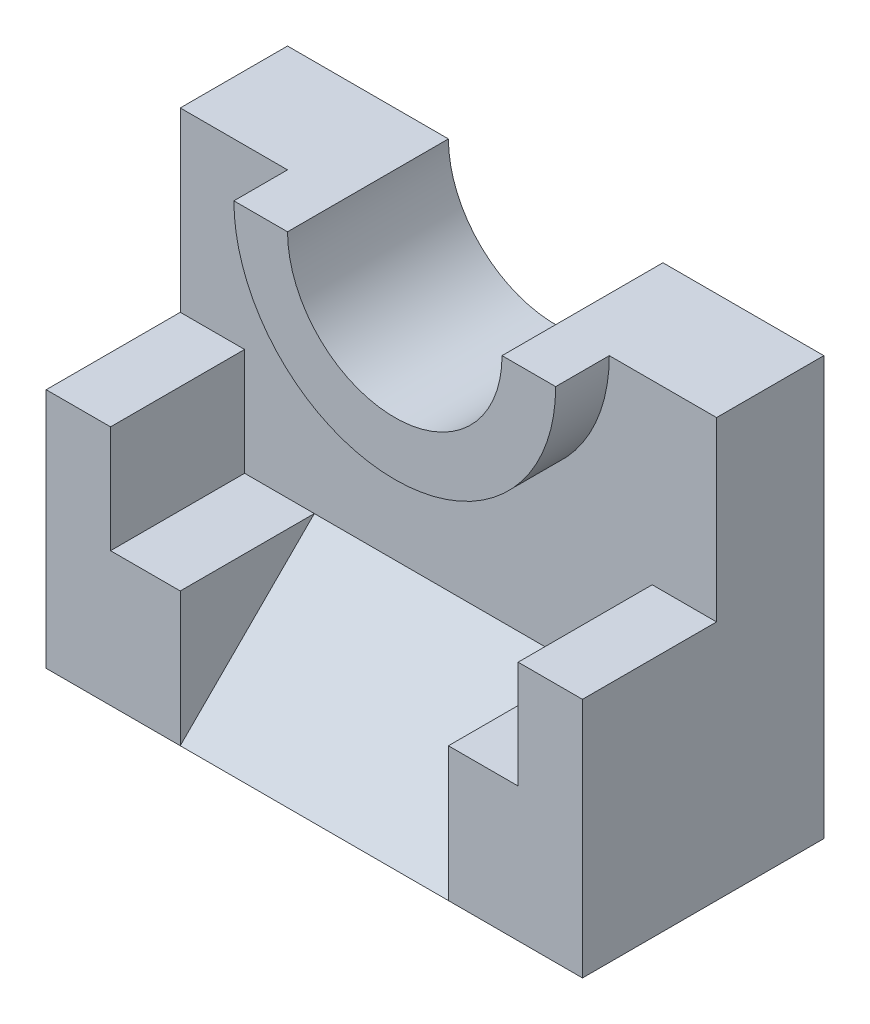
from build123d import *

# Parameters (mm, degrees)
BOSS_EXTRUDE1_DEPTH = 20
BOSS_EXTRUDE2_DEPTH = 30
BOSS_EXTRUDE6_DEPTH = 45
CUT_EXTRUDE6_DEPTH  = 140
BOSS_EXTRUDE7_DEPTH = 25


with BuildPart() as part:
    # Sketch1 → Boss-Extrude1 (new body)
    with BuildSketch(Plane.XY):
        with BuildLine():
            Line((-68.304856892, 40.883398519), (-68.304856892, 7.883398519))
            Line((-68.304856892, 7.883398519), (-56.304856892, 7.883398519))
            Line((-56.304856892, 7.883398519), (-56.304856892, -12.116601481))
            Line((-56.304856892, -12.116601481), (19.695143108, -12.116601481))
            Line((19.695143108, -12.116601481), (19.695143108, 7.883398519))
            Line((19.695143108, 7.883398519), (31.695143108, 7.883398519))
            Line((31.695143108, 7.883398519), (31.695143108, 40.883398519))
            Line((31.695143108, 40.883398519), (11.695143108, 40.883398519))
            ThreePointArc((11.695143108, 40.883398519), (-18.304856892, 10.883398519), (-48.304856892, 40.883398519))
            Line((-48.304856892, 40.883398519), (-68.304856892, 40.883398519))
        make_face()
    extrude(amount=BOSS_EXTRUDE1_DEPTH)

    # Sketch1<3> → Boss-Extrude2 (add)
    with BuildSketch(Plane.XY):
        with BuildLine():
            Line((-38.304856892, 40.883398519), (-48.304856892, 40.883398519))
            ThreePointArc((-48.304856892, 40.883398519), (-18.304856892, 10.883398519), (11.695143108, 40.883398519))
            Line((11.695143108, 40.883398519), (1.695143108, 40.883398519))
            ThreePointArc((1.695143108, 40.883398519), (-18.304856892, 20.883398519), (-38.304856892, 40.883398519))
        make_face()
    extrude(amount=BOSS_EXTRUDE2_DEPTH)

    # Sketch1<6> → Boss-Extrude6 (add)
    with BuildSketch(Plane.XY):
        Polygon((-68.304856892, 7.883398519), (-68.304856892, -37.116601481), (31.695143108, -37.116601481), (31.695143108, 7.883398519), (19.695143108, 7.883398519), (19.695143108, -12.116601481), (-56.304856892, -12.116601481), (-56.304856892, 7.883398519), align=None)
    extrude(amount=BOSS_EXTRUDE6_DEPTH)

    # Sketch3 → Cut-Extrude6 (cut)
    with BuildSketch(Plane.ZY.offset(68.304856892)):
        Polygon((45, -37.116601481), (45, -12.116601481), (20, -12.116601481), align=None)
    extrude(amount=-CUT_EXTRUDE6_DEPTH, mode=Mode.SUBTRACT)

    # Sketch3<2> → Boss-Extrude7 (add)
    with BuildSketch(Plane.ZY.offset(68.304856892)):
        Polygon((45, -37.116601481), (45, -12.116601481), (20, -12.116601481), align=None)
    boss_extrude7 = extrude(amount=-BOSS_EXTRUDE7_DEPTH)

    # Mirror1: Boss-Extrude7 across plane
    add(boss_extrude7.mirror(Plane(origin=(-18.304856892, 0, 0), x_dir=(0, 0, 1), z_dir=(1, 0, 0))))


solid = part.part
